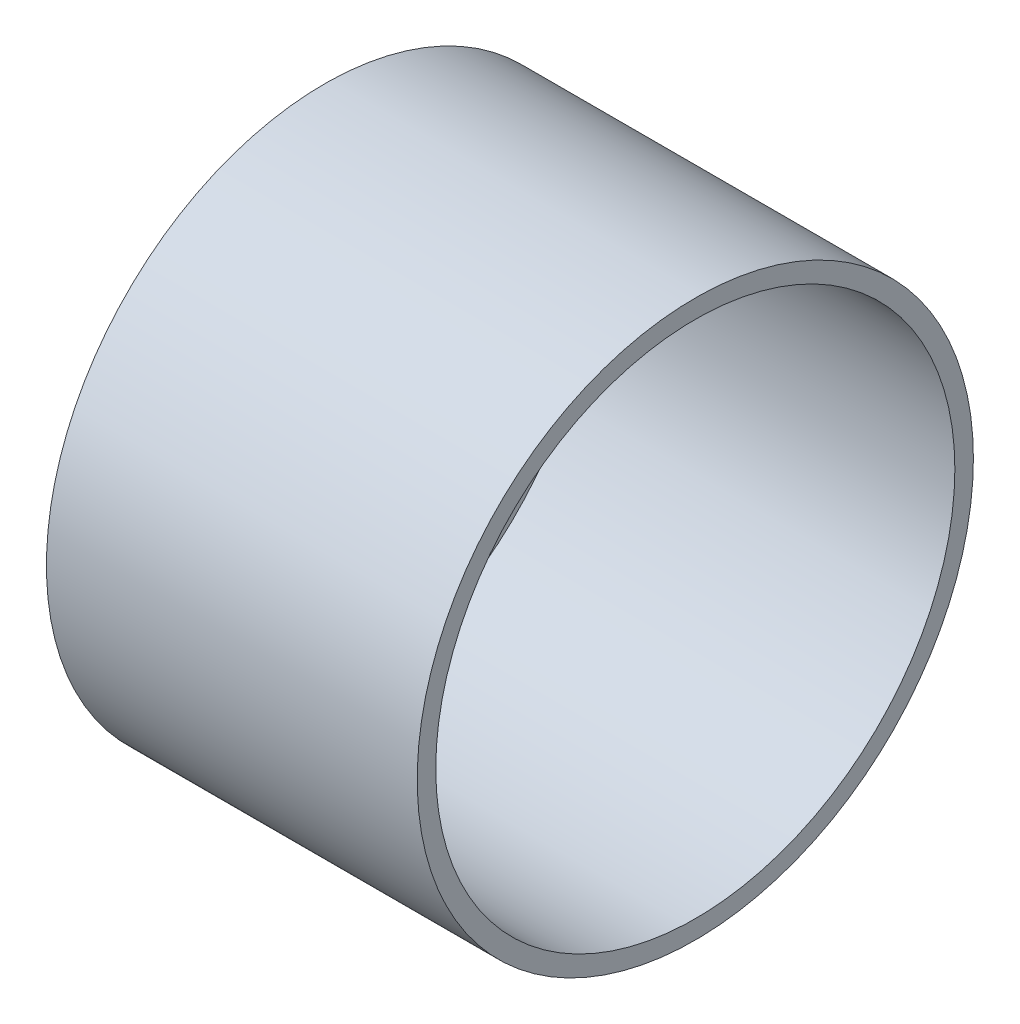
from build123d import *

# Parameters (mm, degrees)
SKETCH1_R                 = 70
BOSS_EXTRUDE1_DEPTH       = 2
SKETCH1_4_R               = 75
SKETCH1_4_R_2             = 70
BOSS_EXTRUDE2_DEPTH       = 100
M3_CLEARANCE_HOLE1_D      = 3.6
M3_CLEARANCE_HOLE1_DEPTH  = 2
M3_CLEARANCE_HOLE1_TIP    = 1.081549114
M10_CLEARANCE_HOLE1_D     = 12
M10_CLEARANCE_HOLE1_DEPTH = 2
M10_CLEARANCE_HOLE1_TIP   = 3.605163714


with BuildPart() as part:
    # Sketch1 → Boss-Extrude1 (new body)
    with BuildSketch(Plane(origin=(0, 0, 0), x_dir=(0, 0, -1), z_dir=(1, 0, 0))):
        Circle(SKETCH1_R)
    extrude(amount=BOSS_EXTRUDE1_DEPTH)

    # Sketch1<4> → Boss-Extrude2 (add)
    with BuildSketch(Plane(origin=(0, 0, 0), x_dir=(0, 0, -1), z_dir=(1, 0, 0))):
        Circle(SKETCH1_4_R)
        Circle(SKETCH1_4_R_2, mode=Mode.SUBTRACT)
    extrude(amount=BOSS_EXTRUDE2_DEPTH)

    # M3 Clearance Hole1
    with Locations(Plane(origin=(2, 0, 0), x_dir=(0, 0, -1), z_dir=(1, 0, 0))):
        with Locations((12.990381057, -7.5), (0, 15), (-12.990381057, -7.5)):
            Hole(M3_CLEARANCE_HOLE1_D / 2, depth=M3_CLEARANCE_HOLE1_DEPTH)
            with Locations((0, 0, -(M3_CLEARANCE_HOLE1_DEPTH + M3_CLEARANCE_HOLE1_TIP / 2))):  # 118° drill point
                Cone(0, M3_CLEARANCE_HOLE1_D / 2, M3_CLEARANCE_HOLE1_TIP, mode=Mode.SUBTRACT)

    # M10 Clearance Hole1
    with Locations(Plane(origin=(2, 0, 0), x_dir=(0, 0, -1), z_dir=(1, 0, 0))):
        with Locations((0, 0)):
            Hole(M10_CLEARANCE_HOLE1_D / 2, depth=M10_CLEARANCE_HOLE1_DEPTH)
            with Locations((0, 0, -(M10_CLEARANCE_HOLE1_DEPTH + M10_CLEARANCE_HOLE1_TIP / 2))):  # 118° drill point
                Cone(0, M10_CLEARANCE_HOLE1_D / 2, M10_CLEARANCE_HOLE1_TIP, mode=Mode.SUBTRACT)


solid = part.part
